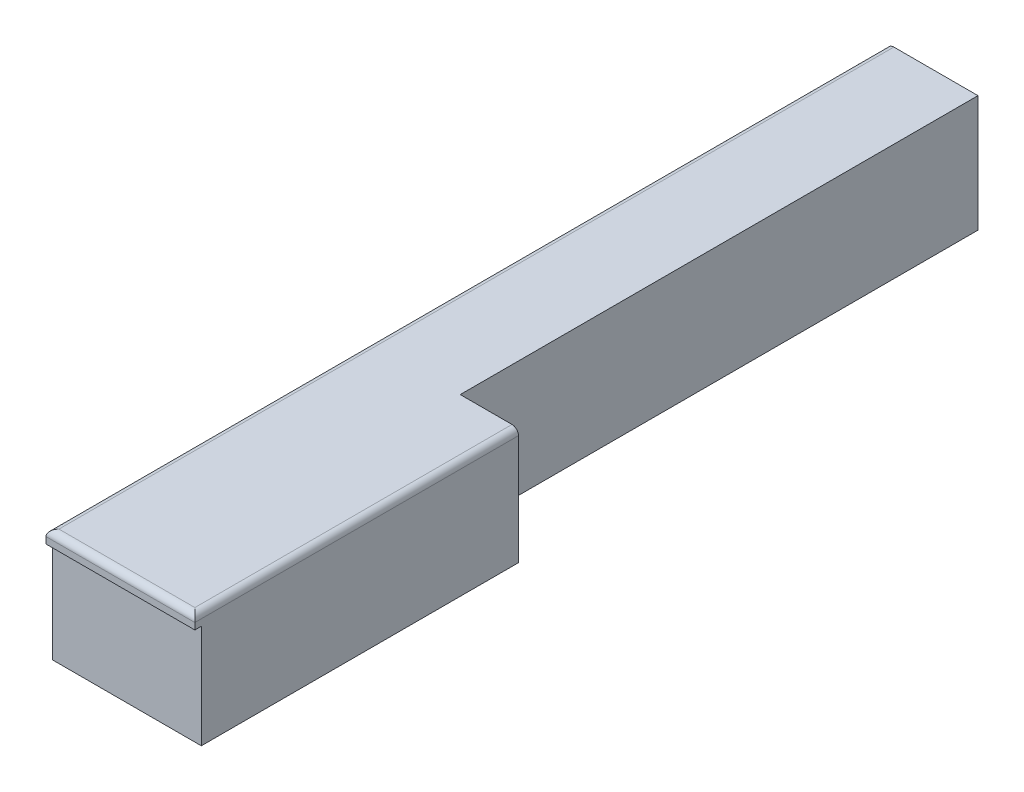
from build123d import *

# Parameters (mm, degrees)
SALIENTE_EXTRUIR1_DEPTH = 18
CROQUIS3_W              = 23
CROQUIS3_H              = 16
CORTAR_EXTRUIR1_DEPTH   = 1
REDONDEO1_R             = 1


with BuildPart() as part:
    # Croquis2 → Saliente-Extruir1 (new body)
    with BuildSketch(Plane(origin=(0, 0, 0), x_dir=(1, 0, 0), z_dir=(0, 1, 0))):
        Polygon((0, 130), (0, 0), (23, 0), (23, 50), (14, 50), (14, 130), align=None)
    extrude(amount=SALIENTE_EXTRUIR1_DEPTH)

    # Croquis3 → Cortar-Extruir1 (cut)
    with BuildSketch(Plane.XY):
        with Locations((11.5, 8)):
            Rectangle(CROQUIS3_W, CROQUIS3_H)
    extrude(amount=-CORTAR_EXTRUIR1_DEPTH, mode=Mode.SUBTRACT)

    # Redondeo1
    redondeo1_edges = [part.edges().sort_by_distance(p)[0] for p in [
        (0, 18, -65),
        (11.5, 18, 0),
        (23, 18, -25),
    ]]
    fillet(redondeo1_edges, radius=REDONDEO1_R)


solid = part.part
